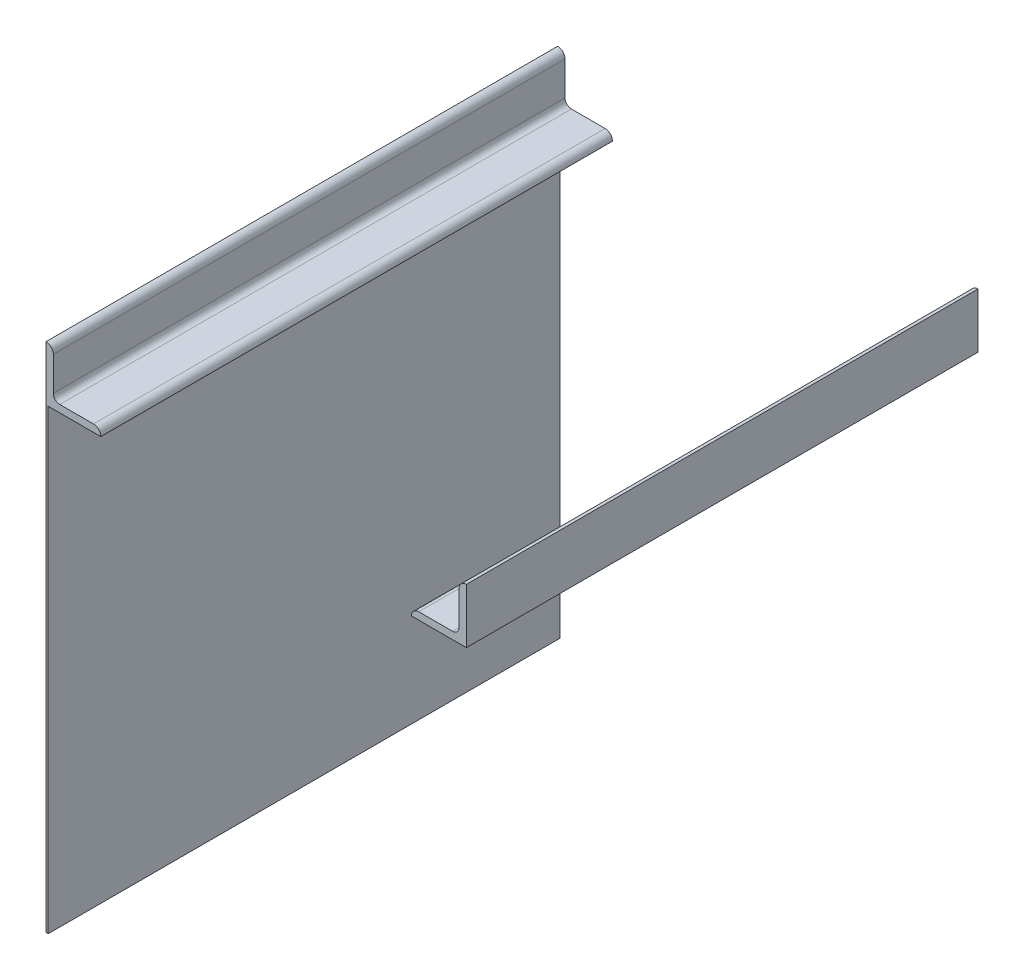
from build123d import *

# Parameters (mm, degrees)
ANGLE_IRON_25_X_25_X_4_1_DEPTH   = 280
ANGLE_IRON_25_X_25_X_4_1_2_DEPTH = 280
SKETCH12_W                       = 1.2
SKETCH12_H                       = 280
BOSS_EXTRUDE1_DEPTH              = 250


with BuildPart() as part:
    # Sketch11 → Angle iron 25 X 25 X 4(1) (new body)
    with BuildSketch(Plane.XY):
        with BuildLine():
            Line((0, 0), (0, 30))
            ThreePointArc((0, 30), (2.828427125, 28.828427125), (4, 26))
            Line((4, 26), (4, 7.5))
            ThreePointArc((4, 7.5), (5.025126266, 5.025126266), (7.5, 4))
            Line((7.5, 4), (26, 4))
            ThreePointArc((26, 4), (28.828427125, 2.828427125), (30, 0))
            Line((30, 0), (0, 0))
        make_face()
    extrude(amount=ANGLE_IRON_25_X_25_X_4_1_DEPTH)


with BuildPart() as body_2:
    # Sketch11 on segment 2 (carried to segment 2) → Angle iron 25 X 25 X 4_1 2 (new body)
    with BuildSketch(Plane(origin=(230, 0, 0), x_dir=(0, 1, 0), z_dir=(0, 0, 1))):
        with BuildLine():
            Line((0, 0), (0, 30))
            ThreePointArc((0, 30), (2.828427125, 28.828427125), (4, 26))
            Line((4, 26), (4, 7.5))
            ThreePointArc((4, 7.5), (5.025126266, 5.025126266), (7.5, 4))
            Line((7.5, 4), (26, 4))
            ThreePointArc((26, 4), (28.828427125, 2.828427125), (30, 0))
            Line((30, 0), (0, 0))
        make_face()
    extrude(amount=ANGLE_IRON_25_X_25_X_4_1_2_DEPTH)


with BuildPart() as body_3:
    # Sketch12 → Boss-Extrude1 (new body)
    with BuildSketch(Plane.XZ):
        with Locations((0.6, 140)):
            Rectangle(SKETCH12_W, SKETCH12_H)
    extrude(amount=BOSS_EXTRUDE1_DEPTH)


solid = Compound([part.part, body_2.part, body_3.part])
